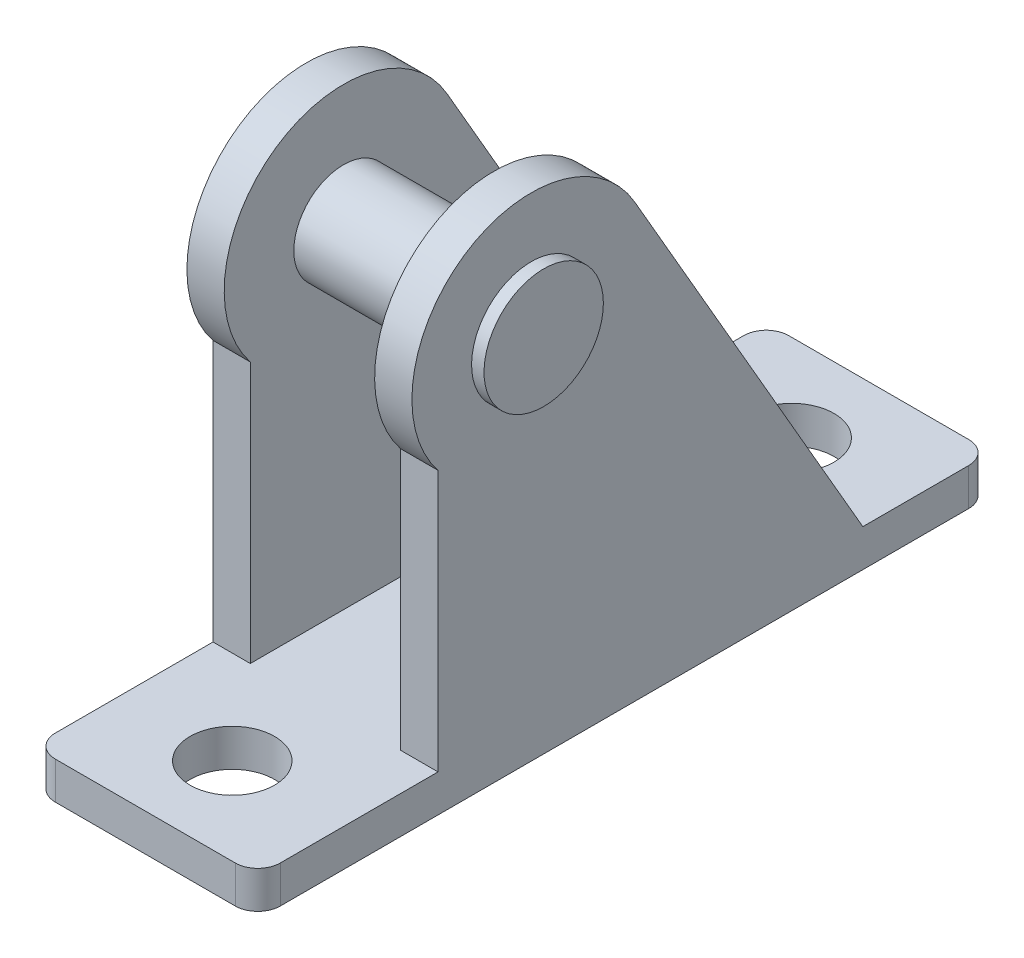
from build123d import *

# Parameters (mm, degrees)
EXTRUDE_START       = -37
EXTRUDE_1_DEPTH     = 59
CUT_EXTRUDE_1_DEPTH = 58.416112721
SKETCH_5_R          = 4
EXTRUDE_2_DEPTH     = 15.1
SKETCH_6_R          = 4.8
EXTRUDE_3_DEPTH     = 1
FILLET_1_R          = 1.81
SKETCH_7_R          = 3.4
CUT_EXTRUDE_2_DEPTH = 54.005306338


with BuildPart() as part:
    # 草图3 → 凸台-拉伸1 (new body)
    with BuildSketch(Plane.XY.offset(EXTRUDE_START)):
        Polygon((-6.05, 3), (-6.05, 40), (-9.05, 40), (-9.05, 0), (9.05, 0), (9.05, 40), (6.05, 40), (6.05, 3), align=None)
    extrude(amount=EXTRUDE_1_DEPTH)

    # 草图4 → 切除-拉伸1 (cut, through all)
    with BuildSketch(Plane(origin=(9.05, 0, 0), x_dir=(0, 0, -1), z_dir=(1, 0, 0))):
        with BuildLine():
            Line((-7.5, 24.007504693), (-7.5, 3))
            Line((-7.5, 3), (-22, 3))
            Line((-22, 3), (-22, 40))
            Line((-22, 40), (37, 40))
            Line((37, 40), (37, 3))
            Line((37, 3), (26.673582437, 3))
            Line((26.673582437, 3), (8.313843876, 34.8))
            ThreePointArc((8.313843876, 34.8), (-5.411568553, 37.929371085), (-7.5, 24.007504693))
        make_face()
    extrude(amount=-CUT_EXTRUDE_1_DEPTH, mode=Mode.SUBTRACT)

    # 草图5 → 凸台-拉伸2 (add)
    with BuildSketch(Plane(origin=(9.05, 0, 0), x_dir=(0, 0, -1), z_dir=(1, 0, 0))):
        with Locations(Location((0, 30, 0), (0, 0, 90))):
            Circle(SKETCH_5_R)
    extrude(amount=-EXTRUDE_2_DEPTH)

    # 草图6 → 凸台-拉伸3 (add)
    with BuildSketch(Plane(origin=(9.05, 0, 0), x_dir=(0, 0, -1), z_dir=(1, 0, 0))):
        with Locations(Location((0, 30, 0), (0, 0, 270))):
            Circle(SKETCH_6_R)
    extrude_3 = extrude(amount=EXTRUDE_3_DEPTH)

    # 镜向1: 凸台-拉伸3 across plane
    add(extrude_3.mirror(Plane(origin=(0, 0, 0), x_dir=(0, 0, 1), z_dir=(1, 0, 0))))

    # 圆角1
    fillet_1_edges = [part.edges().sort_by_distance(p)[0] for p in [
        (9.05, 1.5, 22),
        (-9.05, 1.5, -37),
        (-9.05, 1.5, 22),
        (9.05, 1.5, -37),
    ]]
    fillet(fillet_1_edges, radius=FILLET_1_R)

    # 草图7 → 切除-拉伸2 (cut, through all)
    with BuildSketch(Plane(origin=(0, 3, 0), x_dir=(1, 0, 0), z_dir=(0, 1, 0))):
        with Locations(Location((0, -15, 0), (0, 0, 270))):
            Circle(SKETCH_7_R)
        with Locations(Location((0, 30, 0), (0, 0, 270))):
            Circle(SKETCH_7_R)
    extrude(amount=-CUT_EXTRUDE_2_DEPTH, mode=Mode.SUBTRACT)


solid = part.part
